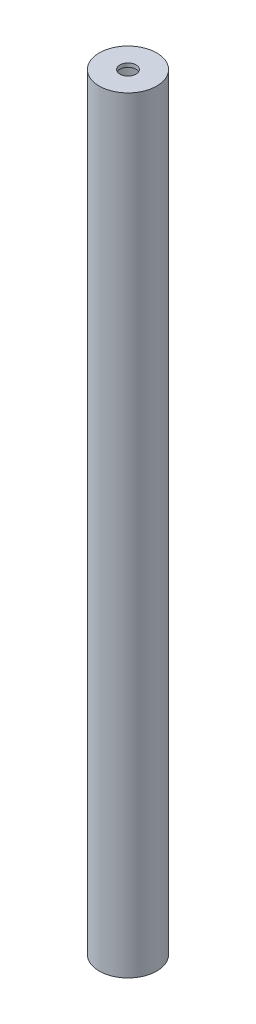
from build123d import *

# Parameters (mm, degrees)
SKETCH_1_R          = 7.5
SKETCH_1_R_2        = 7
EXTRUDE_1_DEPTH     = 200
EXTRUDE_START       = -1
SKETCH_2_R          = 7
EXTRUDE_2_DEPTH     = 1
SKETCH_3_R          = 2.1
CUT_EXTRUDE_1_DEPTH = 10


with BuildPart() as part:
    # 草图1 → 凸台-拉伸1 (new body)
    with BuildSketch(Plane(origin=(0, 0, 0), x_dir=(1, 0, 0), z_dir=(0, 1, 0))):
        with Locations(Location((0, 0, 0), (0, 0, 270))):
            Circle(SKETCH_1_R)
        with Locations(Location((0, 0, 0), (0, 0, 270))):
            Circle(SKETCH_1_R_2, mode=Mode.SUBTRACT)
    extrude(amount=EXTRUDE_1_DEPTH)

    # 草图2 → 凸台-拉伸2 (add)
    with BuildSketch(Plane(origin=(0, 200, 0), x_dir=(1, 0, 0), z_dir=(0, 1, 0)).offset(EXTRUDE_START)):
        with Locations(Location((0, 0, 0), (0, 0, 270))):
            Circle(SKETCH_2_R)
    extrude(amount=EXTRUDE_2_DEPTH)

    # 草图3 → 切除-拉伸1 (cut)
    with BuildSketch(Plane(origin=(0, 200, 0), x_dir=(1, 0, 0), z_dir=(0, 1, 0))):
        with Locations(Location((0, 0, 0), (0, 0, 270))):
            Circle(SKETCH_3_R)
    extrude(amount=-CUT_EXTRUDE_1_DEPTH, mode=Mode.SUBTRACT)


solid = part.part
